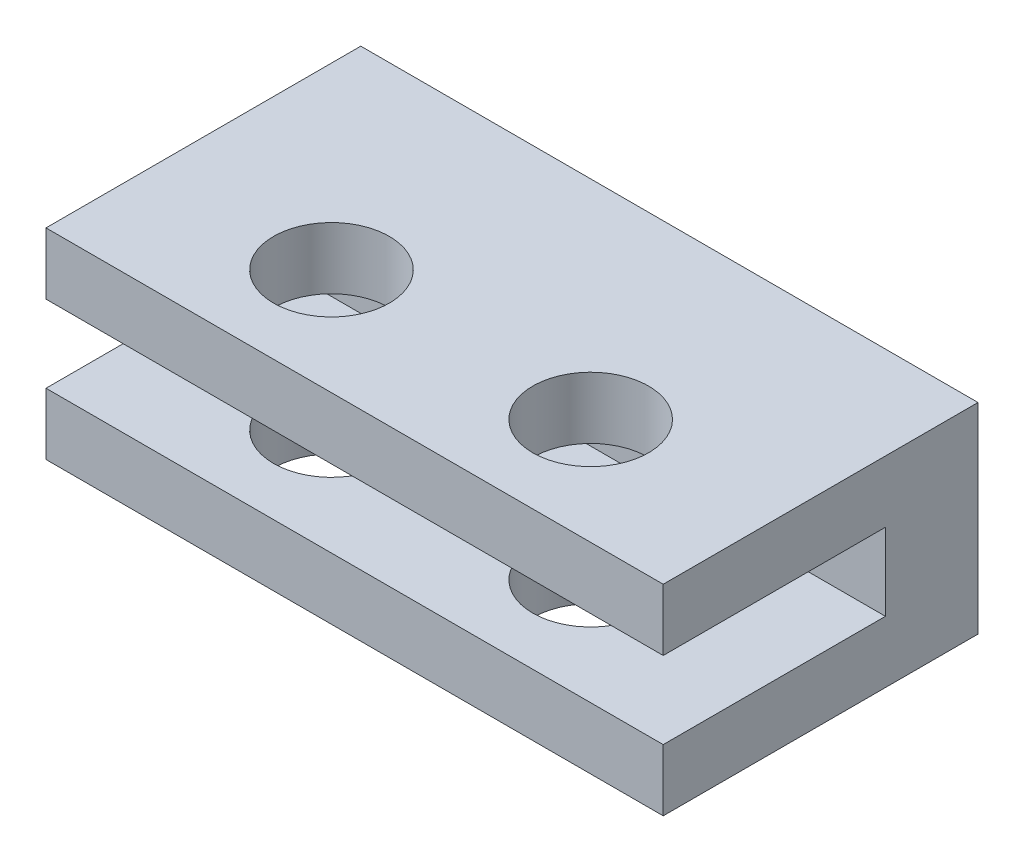
from build123d import *

# Parameters (mm, degrees)
SKETCH1_W           = 50.8
SKETCH1_H           = 25.908
BOSS_EXTRUDE1_DEPTH = 5.08
SKETCH2_W           = 50.8
SKETCH2_H           = 7.62
BOSS_EXTRUDE2_DEPTH = 6.35
SKETCH3_W           = 50.8
SKETCH3_H           = 7.62
BOSS_EXTRUDE3_DEPTH = 5.08
SKETCH4_W           = 50.8
SKETCH4_H           = 5.08
BOSS_EXTRUDE4_DEPTH = 18.288
SKETCH5_R           = 4.7625
CUT_EXTRUDE1_DEPTH  = 33.947628382


with BuildPart() as part:
    # Sketch1 → Boss-Extrude1 (new body)
    with BuildSketch(Plane(origin=(0, 0, 0), x_dir=(1, 0, 0), z_dir=(0, 1, 0))):
        Rectangle(SKETCH1_W, SKETCH1_H)
    extrude(amount=BOSS_EXTRUDE1_DEPTH)

    # Sketch2 → Boss-Extrude2 (add)
    with BuildSketch(Plane(origin=(0, 5.08, 0), x_dir=(1, 0, 0), z_dir=(0, 1, 0))):
        with Locations((0, 9.144)):
            Rectangle(SKETCH2_W, SKETCH2_H)
    extrude(amount=BOSS_EXTRUDE2_DEPTH)

    # Sketch3 → Boss-Extrude3 (add)
    with BuildSketch(Plane(origin=(0, 11.43, 0), x_dir=(1, 0, 0), z_dir=(0, 1, 0))):
        with Locations((0, 9.144)):
            Rectangle(SKETCH3_W, SKETCH3_H)
    extrude(amount=BOSS_EXTRUDE3_DEPTH)

    # Sketch4 → Boss-Extrude4 (add)
    with BuildSketch(Plane.XY.offset(-5.334)):
        with Locations((0, 13.97)):
            Rectangle(SKETCH4_W, SKETCH4_H)
    extrude(amount=BOSS_EXTRUDE4_DEPTH)

    # Sketch5 → Cut-Extrude1 (cut, through all)
    with BuildSketch(Plane(origin=(0, 16.51, 0), x_dir=(1, 0, 0), z_dir=(0, 1, 0))):
        with Locations(Location((-10.668, -4.191, 0), (0, 0, 270))):
            Circle(SKETCH5_R)
        with Locations(Location((10.668, -4.191, 0), (0, 0, 270))):
            Circle(SKETCH5_R)
    extrude(amount=-CUT_EXTRUDE1_DEPTH, mode=Mode.SUBTRACT)


solid = part.part
